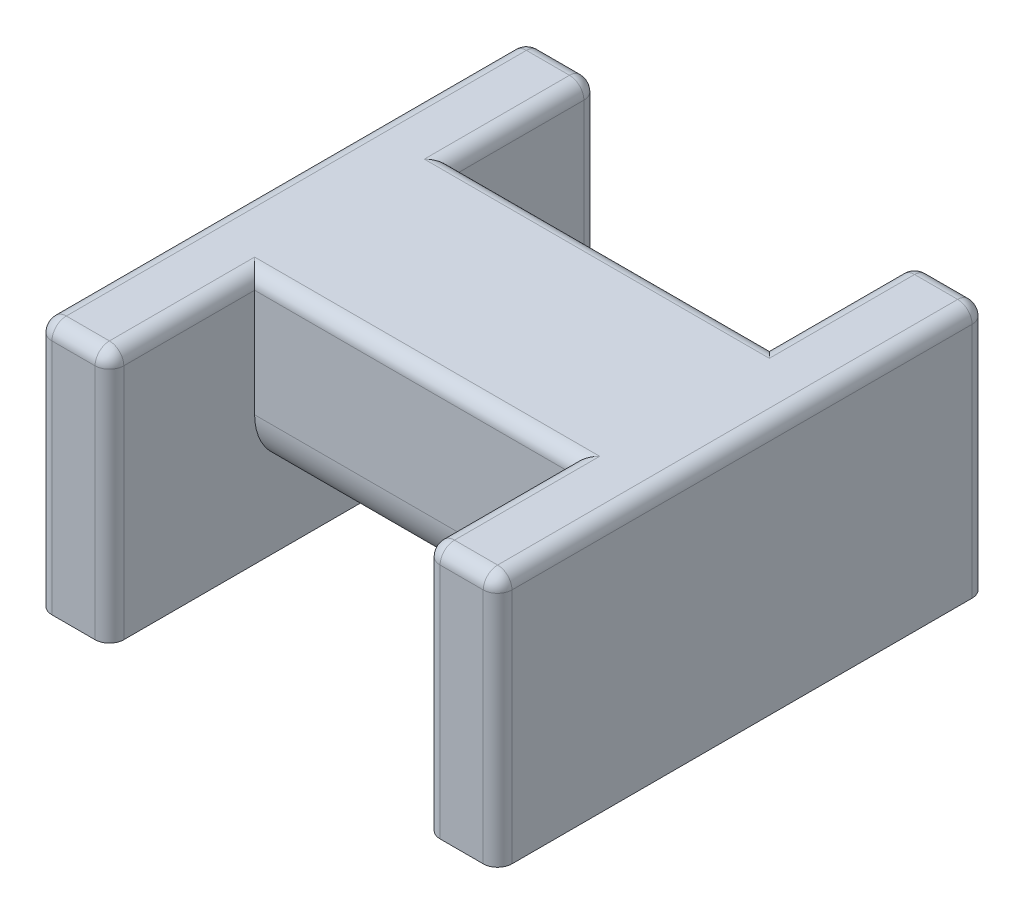
from build123d import *

# Parameters (mm, degrees)
SKETCH1_W           = 13.8
SKETCH1_H           = 10.5
BOSS_EXTRUDE1_DEPTH = 22
BOSS_EXTRUDE2_DEPTH = 5
BOSS_EXTRUDE3_DEPTH = 5
SKETCH4_R           = 1.4
CUT_EXTRUDE1_DEPTH  = 8
SKETCH5_W           = 22
SKETCH5_H           = 10.1
CUT_EXTRUDE2_DEPTH  = 37.390245946
FILLET2_R           = 1
FILLET3_R           = 4


with BuildPart() as part:
    # Sketch1 → Boss-Extrude1 (new body)
    with BuildSketch(Plane(origin=(0, 0, 0), x_dir=(0, 0, -1), z_dir=(1, 0, 0))):
        Polygon((6.9, 5.25), (17, 5.25), (17, 7.25), (-17, 7.25), (-17, 5.25), (-6.9, 5.25), align=None)
        Rectangle(SKETCH1_W, SKETCH1_H)
    extrude(amount=BOSS_EXTRUDE1_DEPTH)

    # Sketch2 → Boss-Extrude2 (add)
    with BuildSketch(Plane(origin=(22, 0, 0), x_dir=(0, 0, -1), z_dir=(1, 0, 0))):
        Polygon((-6.9, 5.25), (-17, 5.25), (-17, -10.25), (17, -10.25), (17, 5.25), (6.9, 5.25), (6.9, -5.25), (-6.9, -5.25), align=None)
        Polygon((-17, 7.25), (-17, 5.25), (-6.9, 5.25), (-6.9, -5.25), (6.9, -5.25), (6.9, 5.25), (17, 5.25), (17, 7.25), align=None)
    extrude(amount=BOSS_EXTRUDE2_DEPTH)

    # Sketch3 → Boss-Extrude3 (add)
    with BuildSketch(Plane.ZY):
        Polygon((17, -10.25), (17, 5.25), (6.9, 5.25), (6.9, -5.25), (-6.9, -5.25), (-6.9, 5.25), (-17, 5.25), (-17, -10.25), align=None)
        Polygon((6.9, -5.25), (6.9, 5.25), (17, 5.25), (17, 7.25), (-17, 7.25), (-17, 5.25), (-6.9, 5.25), (-6.9, -5.25), align=None)
    extrude(amount=BOSS_EXTRUDE3_DEPTH)

    # Sketch4 → Cut-Extrude1 (cut)
    with BuildSketch(Plane.XZ.offset(10.25)):
        with Locations(Location((-2.5, 0, 0), (0, 0, 270))):
            Circle(SKETCH4_R)
        with Locations(Location((24.5, 0, 0), (0, 0, 270))):
            Circle(SKETCH4_R)
    extrude(amount=-CUT_EXTRUDE1_DEPTH, mode=Mode.SUBTRACT)

    # Sketch5 → Cut-Extrude2 (cut, through all)
    with BuildSketch(Plane(origin=(0, 7.25, 0), x_dir=(1, 0, 0), z_dir=(0, 1, 0))):
        with Locations((11, -11.95)):
            Rectangle(SKETCH5_W, SKETCH5_H)
        with Locations((11, 11.95)):
            Rectangle(SKETCH5_W, SKETCH5_H)
    extrude(amount=-CUT_EXTRUDE2_DEPTH, mode=Mode.SUBTRACT)

    # Fillet2
    fillet2_edges = [part.edges().sort_by_distance(p)[0] for p in [
        (24.5, 7.25, 17),
        (24.5, 7.25, -17),
        (22, -1.5, -17),
        (27, -1.5, -17),
        (22, -1.5, 17),
        (27, 7.25, 0),
        (27, -1.5, 17),
        (-5, -1.5, 17),
        (0, -1.5, -17),
        (-5, 7.25, 0),
        (-5, -1.5, -17),
        (0, -1.5, 17),
        (-2.5, 7.25, 17),
        (-2.5, 7.25, -17),
        (22, 7.25, 11.95),
        (11, 7.25, 6.9),
        (0, 7.25, 11.95),
        (11, 7.25, -6.9),
        (22, 7.25, -11.95),
        (0, 7.25, -11.95),
    ]]
    fillet(fillet2_edges, radius=FILLET2_R)

    # Fillet3
    fillet3_edges = [part.edges().sort_by_distance(p)[0] for p in [
        (11, -5.25, -6.9),
        (11, -5.25, 6.9),
    ]]
    fillet(fillet3_edges, radius=FILLET3_R)


solid = part.part
